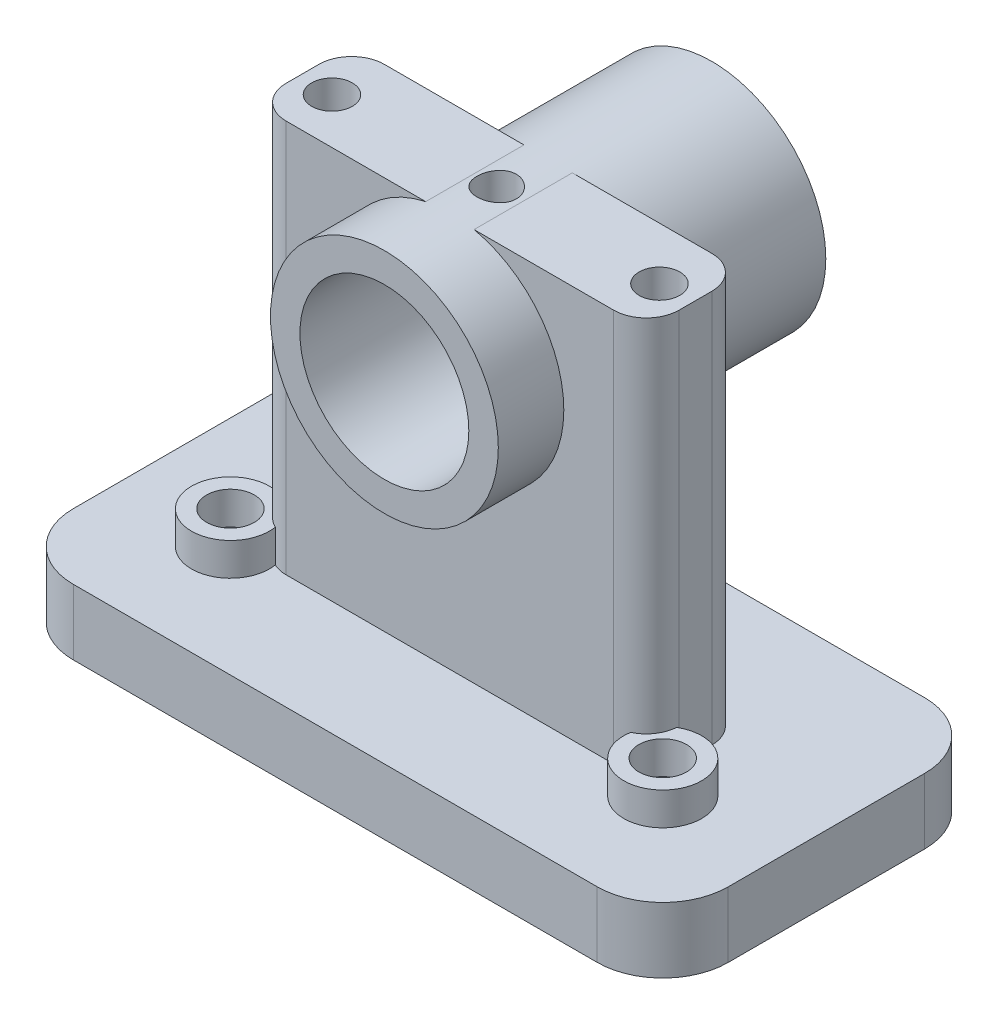
from build123d import *

# Parameters (mm, degrees)
BOSS_EXTRUDE2_DEPTH = 10
BOSS_EXTRUDE4_DEPTH = 60
SKETCH4_R           = 5.950427228
SKETCH4_R_2         = 3.640178542
BOSS_EXTRUDE5_DEPTH = 5
SKETCH9_R           = 17.396356036
SKETCH9_R_2         = 12.893034815
BOSS_EXTRUDE7_DEPTH = 50
SKETCH11_R          = 12.893034815
CUT_EXTRUDE2_DEPTH  = 96.902358539
SKETCH12_R          = 3.108842341
CUT_EXTRUDE5_DEPTH  = 63
SKETCH16_R          = 3.004688719
CUT_EXTRUDE6_DEPTH  = 66


with BuildPart() as part:
    # Sketch1 → Boss-Extrude2 (new body)
    with BuildSketch(Plane(origin=(0, 0, 0), x_dir=(1, 0, 0), z_dir=(0, 1, 0))):
        with BuildLine():
            Line((-38.603351955, 28.351955307), (41.396648045, 28.351955307))
            ThreePointArc((41.396648045, 28.351955307), (48.467715857, 25.423023119), (51.396648045, 18.351955307))
            Line((51.396648045, 18.351955307), (51.396648045, -11.648044693))
            ThreePointArc((51.396648045, -11.648044693), (48.467715857, -18.719112505), (41.396648045, -21.648044693))
            Line((41.396648045, -21.648044693), (-38.603351955, -21.648044693))
            ThreePointArc((-38.603351955, -21.648044693), (-45.674419767, -18.719112505), (-48.603351955, -11.648044693))
            Line((-48.603351955, -11.648044693), (-48.603351955, 18.351955307))
            ThreePointArc((-48.603351955, 18.351955307), (-45.674419767, 25.423023119), (-38.603351955, 28.351955307))
        make_face()
    extrude(amount=BOSS_EXTRUDE2_DEPTH)

    # Sketch3 → Boss-Extrude4 (add)
    with BuildSketch(Plane(origin=(0, 10, 0), x_dir=(1, 0, 0), z_dir=(0, 1, 0))):
        with BuildLine():
            Line((-23.603351955, 10.851955307), (26.396648045, 10.851955307))
            ThreePointArc((26.396648045, 10.851955307), (29.932181951, 9.387489213), (31.396648045, 5.851955307))
            Line((31.396648045, 5.851955307), (31.396648045, 0.851955307))
            ThreePointArc((31.396648045, 0.851955307), (29.932181951, -2.683578599), (26.396648045, -4.148044693))
            Line((26.396648045, -4.148044693), (-23.603351955, -4.148044693))
            ThreePointArc((-23.603351955, -4.148044693), (-27.138885861, -2.683578599), (-28.603351955, 0.851955307))
            Line((-28.603351955, 0.851955307), (-28.603351955, 5.851955307))
            ThreePointArc((-28.603351955, 5.851955307), (-27.138885861, 9.387489213), (-23.603351955, 10.851955307))
        make_face()
    extrude(amount=BOSS_EXTRUDE4_DEPTH)

    # Sketch4 → Boss-Extrude5 (add)
    # profile 1 of 2: a face of its own
    with BuildSketch(Plane(origin=(0, 10, 0), x_dir=(1, 0, 0), z_dir=(0, 1, 0))):
        with Locations((34.396648045, -4.648044693)):
            Circle(SKETCH4_R)
        with Locations(Location((34.396648045, -4.648044693, 0), (0, 0, 270))):
            Circle(SKETCH4_R_2, mode=Mode.SUBTRACT)
    # profile 2 of 2: a face of its own
    with BuildSketch(Plane(origin=(0, 10, 0), x_dir=(1, 0, 0), z_dir=(0, 1, 0))):
        with Locations((-31.603351955, -4.648044693)):
            Circle(SKETCH4_R)
        with Locations(Location((-31.603351955, -4.648044693, 0), (0, 0, 90))):
            Circle(SKETCH4_R_2, mode=Mode.SUBTRACT)
    extrude(amount=BOSS_EXTRUDE5_DEPTH)

    # Sketch9 → Boss-Extrude7 (add)
    with BuildSketch(Plane.XY.offset(14.148044693)):
        with Locations((1.396648045, 53)):
            Circle(SKETCH9_R)
        with Locations((1.396648045, 53)):
            Circle(SKETCH9_R_2, mode=Mode.SUBTRACT)
    extrude(amount=-BOSS_EXTRUDE7_DEPTH)

    # Sketch11 → Cut-Extrude2 (cut, through all)
    with BuildSketch(Plane.XY.offset(4.148044693)):
        with Locations((1.396648045, 53)):
            Circle(SKETCH11_R)
    extrude(amount=-CUT_EXTRUDE2_DEPTH, mode=Mode.SUBTRACT)

    # Sketch12 → Cut-Extrude5 (cut)
    with BuildSketch(Plane(origin=(0, 70, 0), x_dir=(1, 0, 0), z_dir=(0, 1, 0))):
        with Locations(Location((26.396648045, 2.851955307, 0), (0, 0, 270))):
            Circle(SKETCH12_R)
        with Locations(Location((-23.603351955, 2.851955307, 0), (0, 0, 90))):
            Circle(SKETCH12_R)
    extrude(amount=-CUT_EXTRUDE5_DEPTH, mode=Mode.SUBTRACT)

    # Sketch16 → Cut-Extrude6 (cut)
    with BuildSketch(Plane(origin=(0, 75, 0), x_dir=(1, 0, 0), z_dir=(0, 1, 0))):
        with Locations(Location((1.396648045, 2.996607423, 0), (0, 0, 270))):
            Circle(SKETCH16_R)
    extrude(amount=-CUT_EXTRUDE6_DEPTH, mode=Mode.SUBTRACT)


solid = part.part
